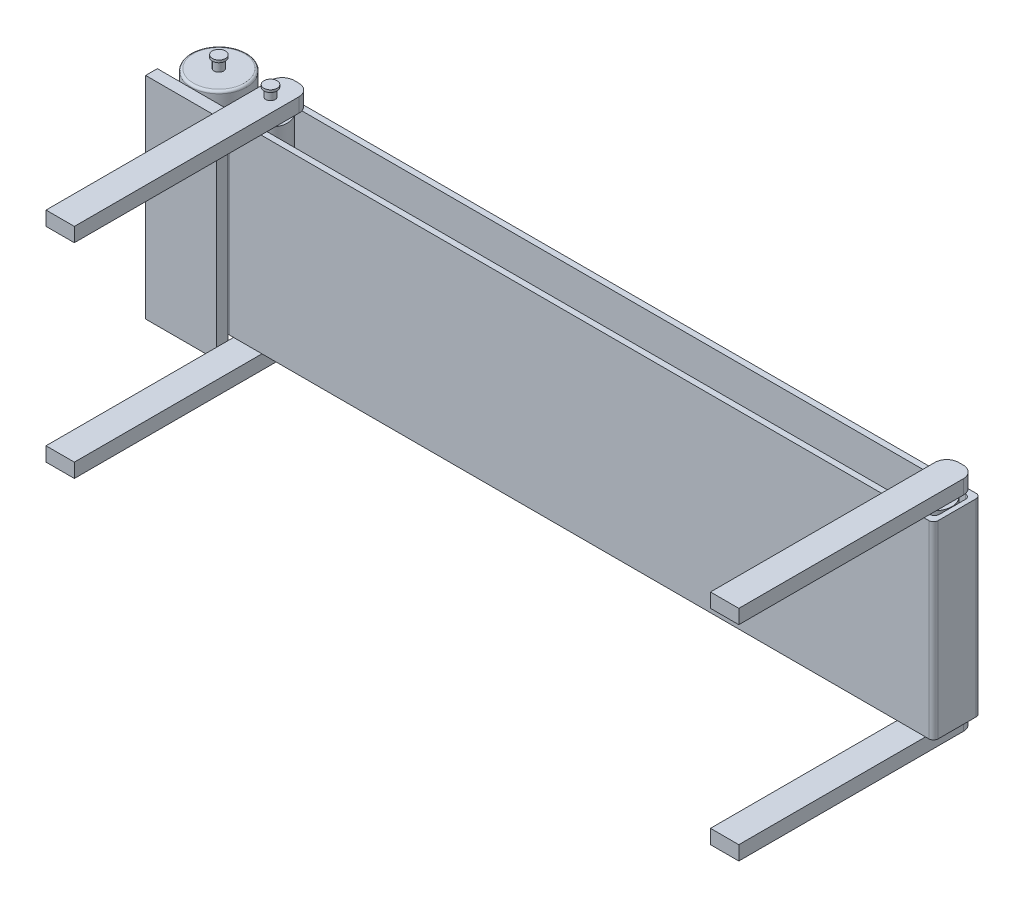
from build123d import *

# Parameters (mm, degrees)
SALIENTE_EXTRUIR1_DEPTH       = 40
CORTAR_EXTRUIR5_DEPTH         = 40
CORTAR_EXTRUIR5_DEPTH_BACK    = 40
CROQUIS6_R                    = 3.6
SALIENTE_EXTRUIR2_DEPTH       = 40
SALIENTE_EXTRUIR3_DEPTH       = 0.2
SALIENTE_EXTRUIR3_DEPTH_BACK  = 40.3
CROQUIS7_R                    = 1.004336789
CROQUIS8_R                    = 3.6
SALIENTE_EXTRUIR4_DEPTH       = 40
SALIENTE_EXTRUIR5_DEPTH       = 0.2
SALIENTE_EXTRUIR5_DEPTH_BACK  = 40.3
CROQUIS9_R                    = 1
SALIENTE_EXTRUIR7_DEPTH       = 3
SALIENTE_EXTRUIR8_DEPTH       = 3
SALIENTE_EXTRUIR9_DEPTH       = 3
SALIENTE_EXTRUIR10_DEPTH      = 3
CROQUIS15_R                   = 1
SALIENTE_EXTRUIR11_DEPTH      = 2
SALIENTE_EXTRUIR12_DEPTH      = 0.25
SALIENTE_EXTRUIR12_DEPTH_BACK = 0.25
CROQUIS16_R                   = 1.390331977
CROQUIS17_W                   = 2.480806326
CROQUIS17_H                   = 44.649028396
SALIENTE_EXTRUIR13_DEPTH      = 15
CROQUIS18_R                   = 1.39
SALIENTE_EXTRUIR14_DEPTH      = 0.5
CROQUIS19_R                   = 1.006716992
SALIENTE_EXTRUIR15_DEPTH      = 2.5
CROQUIS20_R                   = 5.9
SALIENTE_EXTRUIR17_DEPTH      = 22.5
REDONDEO2_R                   = 4
REDONDEO4_R                   = 0.5


with BuildPart() as part:
    # Croquis1 → Saliente-Extruir1 (new body)
    with BuildSketch(Plane(origin=(0, 0, 0), x_dir=(1, 0, 0), z_dir=(0, 1, 0))):
        with BuildLine():
            Line((-74, -5), (74, -5))
            ThreePointArc((74, -5), (74.707106781, -4.707106781), (75, -4))
            Line((75, -4), (75, 4))
            ThreePointArc((75, 4), (74.707106781, 4.707106781), (74, 5))
            Line((74, 5), (-74, 5))
            ThreePointArc((-74, 5), (-74.707106781, 4.707106781), (-75, 4))
            Line((-75, 4), (-75, -4))
            ThreePointArc((-75, -4), (-74.707106781, -4.707106781), (-74, -5))
        make_face()
    extrude(amount=SALIENTE_EXTRUIR1_DEPTH)

    # Croquis5 → Cortar-Extruir5 (cut, two sides: drawn at the far end of the back side and taken through both)
    with BuildSketch(Plane(origin=(0, 0, 0), x_dir=(1, 0, 0), z_dir=(0, 1, 0)).offset(-CORTAR_EXTRUIR5_DEPTH_BACK)):
        with BuildLine():
            Line((73, -3.75), (-73, -3.75))
            ThreePointArc((-73, -3.75), (-73.707106781, -3.457106781), (-74, -2.75))
            Line((-74, -2.75), (-74, 2.75))
            ThreePointArc((-74, 2.75), (-73.707106781, 3.457106781), (-73, 3.75))
            Line((-73, 3.75), (73, 3.75))
            ThreePointArc((73, 3.75), (73.707106781, 3.457106781), (74, 2.75))
            Line((74, 2.75), (74, -2.75))
            ThreePointArc((74, -2.75), (73.707106781, -3.457106781), (73, -3.75))
        make_face()
    extrude(amount=CORTAR_EXTRUIR5_DEPTH + CORTAR_EXTRUIR5_DEPTH_BACK, mode=Mode.SUBTRACT)



with BuildPart() as body_2:
    # Croquis6 → Saliente-Extruir2 (new body)
    with BuildSketch(Plane(origin=(0, 0, 0), x_dir=(1, 0, 0), z_dir=(0, 1, 0))):
        with Locations((70.3, 0)):
            Circle(CROQUIS6_R)
    extrude(amount=SALIENTE_EXTRUIR2_DEPTH)

    # Croquis7 → Saliente-Extruir3 (add, two sides: drawn at the far end of the back side and taken through both)
    with BuildSketch(Plane(origin=(0, 0, 0), x_dir=(-1, 0, 0), z_dir=(0, -1, 0)).offset(-SALIENTE_EXTRUIR3_DEPTH_BACK)):
        with Locations((-70.3, 0)):
            Circle(CROQUIS7_R)
    extrude(amount=SALIENTE_EXTRUIR3_DEPTH + SALIENTE_EXTRUIR3_DEPTH_BACK)


with BuildPart() as body_3:
    # Croquis8 → Saliente-Extruir4 (new body)
    with BuildSketch(Plane(origin=(0, 0, 0), x_dir=(1, 0, 0), z_dir=(0, 1, 0))):
        with Locations((-70.3, 0)):
            Circle(CROQUIS8_R)
    extrude(amount=SALIENTE_EXTRUIR4_DEPTH)

    # Croquis9 → Saliente-Extruir5 (add, two sides: drawn at the far end of the back side and taken through both)
    with BuildSketch(Plane(origin=(0, 0, 0), x_dir=(-1, 0, 0), z_dir=(0, -1, 0)).offset(-SALIENTE_EXTRUIR5_DEPTH_BACK)):
        with Locations((70.306536117, 0)):
            Circle(CROQUIS9_R)
    extrude(amount=SALIENTE_EXTRUIR5_DEPTH + SALIENTE_EXTRUIR5_DEPTH_BACK)

    # Croquis11 → Saliente-Extruir7 (add)
    with BuildSketch(Plane(origin=(0, -0.2, 0), x_dir=(-1, 0, 0), z_dir=(0, -1, 0))):
        with BuildLine():
            Line((67.306536117, 0), (67.306536117, 3))
            ThreePointArc((67.306536117, 3), (68.038769164, 4.767766953), (69.806536117, 5.5))
            Line((69.806536117, 5.5), (70.806536117, 5.5))
            ThreePointArc((70.806536117, 5.5), (72.57430307, 4.767766953), (73.306536117, 3))
            Line((73.306536117, 3), (73.306536117, 0))
            Line((73.306536117, 0), (73.306536117, -44.5))
            Line((73.306536117, -44.5), (67.306536117, -44.5))
            Line((67.306536117, -44.5), (67.306536117, 0))
        make_face()
    extrude(amount=SALIENTE_EXTRUIR7_DEPTH)


with BuildPart() as part_1:
    add(part.part)

    add(body_2.part)  # Saliente-Extruir8 merges body 2
    # Croquis12 → Saliente-Extruir8 (add)
    with BuildSketch(Plane(origin=(0, 0, 0), x_dir=(-1, 0, 0), z_dir=(0, -1, 0))):
        with BuildLine():
            Line((-73.3, 0), (-73.3, 3.000270976))
            ThreePointArc((-73.3, 3.000270976), (-72.567766953, 4.768037929), (-70.8, 5.500270976))
            Line((-70.8, 5.500270976), (-69.802345903, 5.500270976))
            ThreePointArc((-69.802345903, 5.500270976), (-68.03457895, 4.768037929), (-67.302345903, 3.000270976))
            Line((-67.302345903, 3.000270976), (-67.302345903, 0))
            Line((-67.302345903, 0), (-67.302345903, -44.502121213))
            Line((-67.302345903, -44.502121213), (-73.3, -44.502121213))
            Line((-73.3, -44.502121213), (-73.3, 0))
        make_face()
    extrude(amount=SALIENTE_EXTRUIR8_DEPTH)


    add(body_3.part)  # Saliente-Extruir10 merges body 3
    # Croquis14 → Saliente-Extruir10 (add)
    with BuildSketch(Plane(origin=(0, 40, 0), x_dir=(1, 0, 0), z_dir=(0, 1, 0))):
        with BuildLine():
            Line((-73.301674295, 0), (-73.301674295, 3))
            ThreePointArc((-73.301674295, 3), (-72.569441248, 4.767766953), (-70.801674295, 5.5))
            Line((-70.801674295, 5.5), (-69.800220238, 5.5))
            ThreePointArc((-69.800220238, 5.5), (-68.032335762, 4.767649422), (-67.30022026, 2.999667584))
            Line((-67.30022026, 2.999667584), (-67.306536117, -44.5))
            Line((-67.306536117, -44.5), (-73.301674295, -44.5))
            Line((-73.301674295, -44.5), (-73.301674295, 0))
        make_face()
    extrude(amount=SALIENTE_EXTRUIR10_DEPTH)

    # Croquis15 → Saliente-Extruir11 (add)
    with BuildSketch(Plane(origin=(0, 43, 0), x_dir=(1, 0, 0), z_dir=(0, 1, 0))):
        with Locations((-70.3, 0)):
            Circle(CROQUIS15_R)
    extrude(amount=SALIENTE_EXTRUIR11_DEPTH)

    # Croquis16 → Saliente-Extruir12 (add, two sides: drawn at the far end of the back side and taken through both)
    with BuildSketch(Plane(origin=(0, 45.01, 0), x_dir=(1, 0, 0), z_dir=(0, 1, 0)).offset(-SALIENTE_EXTRUIR12_DEPTH_BACK)):
        with Locations((-70.3, 0)):
            Circle(CROQUIS16_R)
    extrude(amount=SALIENTE_EXTRUIR12_DEPTH + SALIENTE_EXTRUIR12_DEPTH_BACK)


with BuildPart() as body_3_2:
    # Croquis13 → Saliente-Extruir9 (new body)
    with BuildSketch(Plane(origin=(0, 40.31, 0), x_dir=(1, 0, 0), z_dir=(0, 1, 0))):
        with BuildLine():
            Line((67.304998702, 0), (67.304998702, 2.996670167))
            ThreePointArc((67.304998702, 2.996670167), (68.037231749, 4.76443712), (69.804998702, 5.496670167))
            Line((69.804998702, 5.496670167), (70.800948612, 5.496670167))
            ThreePointArc((70.800948612, 5.496670167), (72.568733217, 4.764419468), (73.300948612, 2.996620239))
            Line((73.300948612, 2.996620239), (73.3, -44.502121213))
            Line((73.3, -44.502121213), (67.302345903, -44.502121213))
            Line((67.302345903, -44.502121213), (67.304998702, 0))
        make_face()
    extrude(amount=SALIENTE_EXTRUIR9_DEPTH)


with BuildPart() as body_3_3:
    # Croquis17 → Saliente-Extruir13 (new body)
    with BuildSketch(Plane.ZY.offset(73.316536117)):
        with Locations((7.168850189, 19.792884291)):
            Rectangle(CROQUIS17_W, CROQUIS17_H)
    extrude(amount=SALIENTE_EXTRUIR13_DEPTH)


with BuildPart() as body_4:
    # Croquis18 → Saliente-Extruir14 (new body)
    with BuildSketch(Plane(origin=(0, 45.26, 0), x_dir=(1, 0, 0), z_dir=(0, 1, 0))):
        with Locations((-81.222340587, 0)):
            Circle(CROQUIS18_R)
    extrude(amount=-SALIENTE_EXTRUIR14_DEPTH)

    # Croquis19 → Saliente-Extruir15 (add)
    with BuildSketch(Plane(origin=(0, 45.26, 0), x_dir=(1, 0, 0), z_dir=(0, 1, 0))):
        with Locations((-81.222340587, 0)):
            Circle(CROQUIS19_R)
    extrude(amount=-SALIENTE_EXTRUIR15_DEPTH)


with BuildPart() as body_5:
    # Croquis20 → Saliente-Extruir17 (new body)
    with BuildSketch(Plane(origin=(0, 42.75, 0), x_dir=(-1, 0, 0), z_dir=(0, -1, 0))):
        with Locations((81.222340587, 0)):
            Circle(CROQUIS20_R)
    extrude(amount=SALIENTE_EXTRUIR17_DEPTH)

    # Redondeo2
    redondeo2_edges = [body_5.edges().sort_by_distance(p)[0] for p in [
        (-75.322340587, 20.25, 0),
    ]]
    fillet(redondeo2_edges, radius=REDONDEO2_R)

    # Redondeo4
    redondeo4_edges = [body_5.edges().sort_by_distance(p)[0] for p in [
        (-75.322340587, 42.75, 0),
    ]]
    fillet(redondeo4_edges, radius=REDONDEO4_R)


solid = Compound([part_1.part, body_3_2.part, body_3_3.part, body_4.part, body_5.part])
